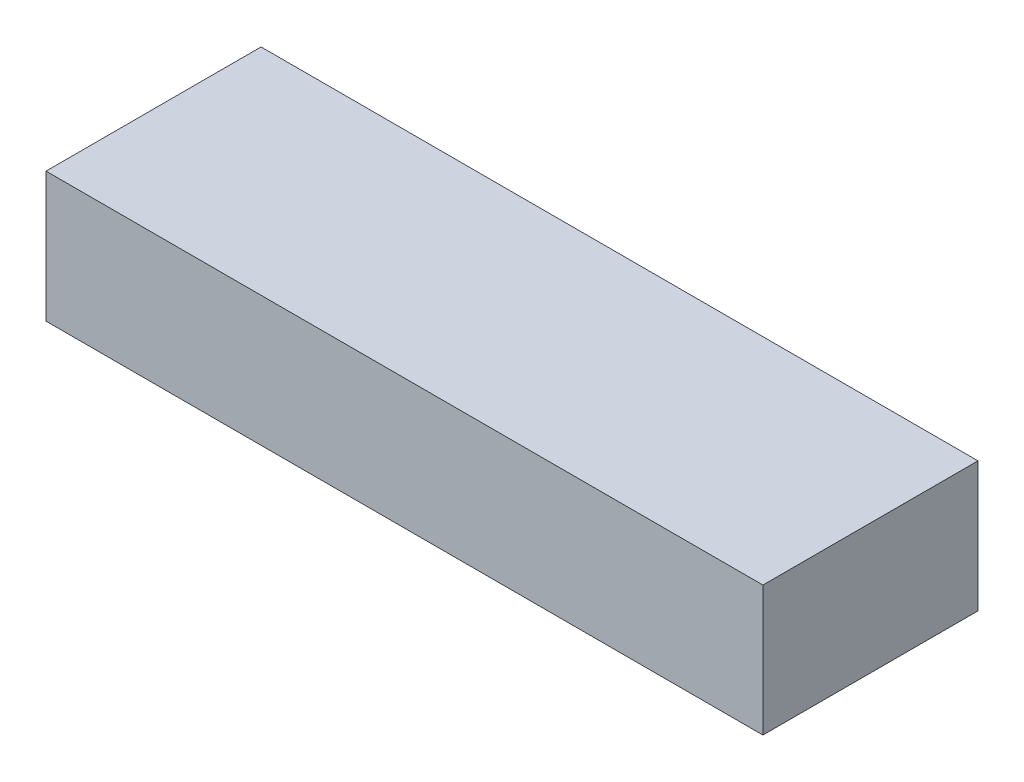
from build123d import *

# Parameters (mm, degrees)
IZIM1_W                     = 160
IZIM1_H                     = 48
Y_KSEKLIK_EKSTR_ZYON1_DEPTH = 29


with BuildPart() as part:
    # Çizim1 → Yükseklik-Ekstrüzyon1 (new body)
    with BuildSketch(Plane(origin=(0, 0, 0), x_dir=(1, 0, 0), z_dir=(0, 1, 0))):
        Rectangle(IZIM1_W, IZIM1_H)
    extrude(amount=Y_KSEKLIK_EKSTR_ZYON1_DEPTH)


solid = part.part
